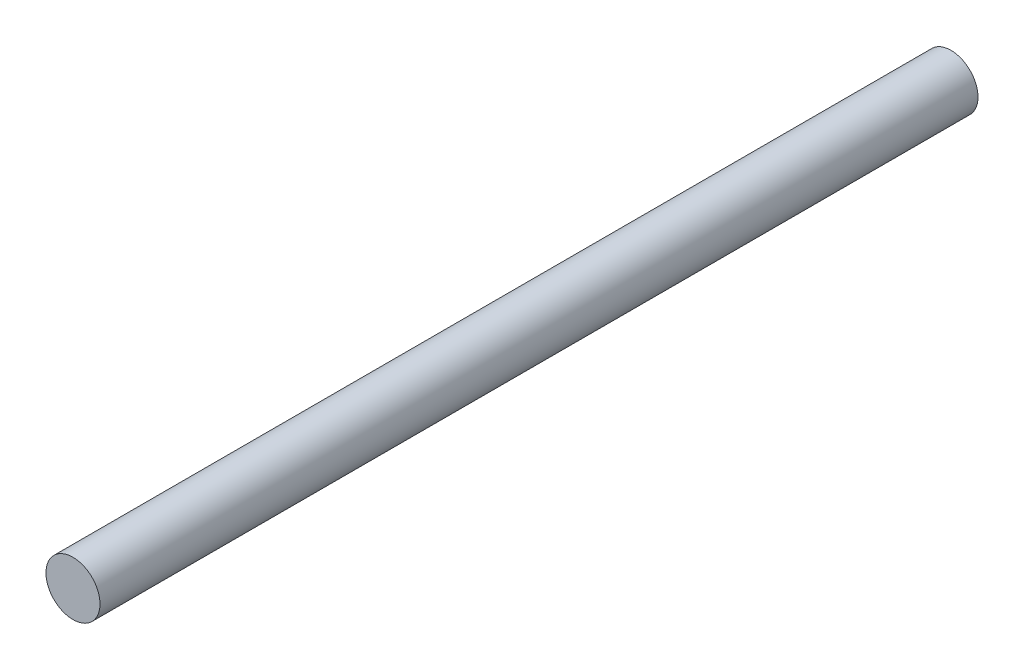
from build123d import *

# Parameters (mm, degrees)
CROQUIS1_R              = 4
SALIENTE_EXTRUIR1_DEPTH = 130


with BuildPart() as part:
    # Croquis1 → Saliente-Extruir1 (new body)
    with BuildSketch(Plane.XY):
        Circle(CROQUIS1_R)
    extrude(amount=SALIENTE_EXTRUIR1_DEPTH)


solid = part.part
